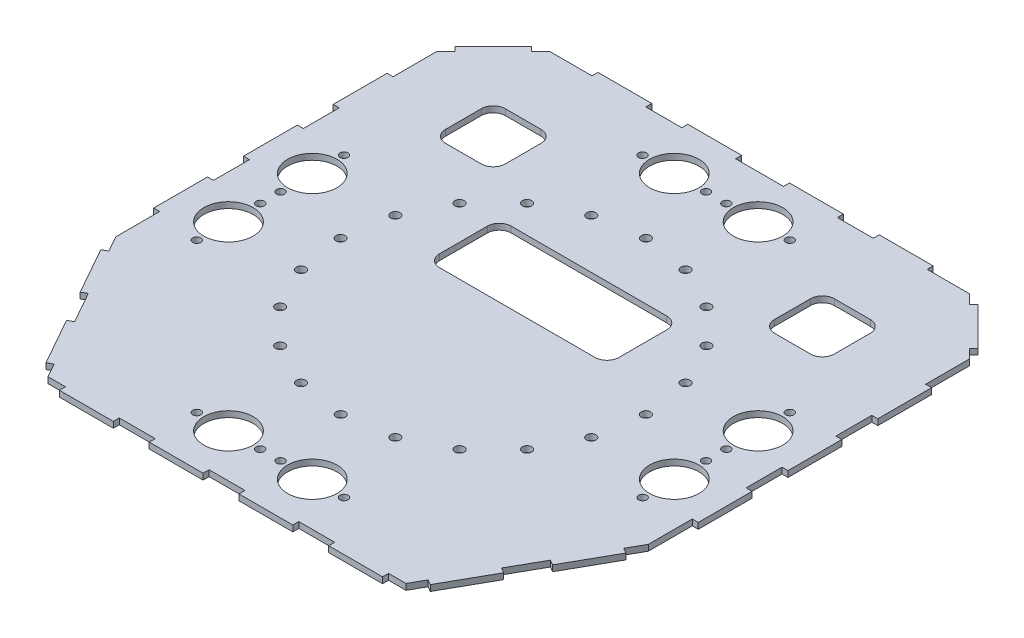
from build123d import *

# Parameters (mm, degrees)
ESQUISSE1_R             = 7.75
ESQUISSE1_R_2           = 41.25
ESQUISSE1_R_3           = 6.75
ESQUISSE1_W             = 300
ESQUISSE1_H             = 120
BOSS_EXTRU_1_DEPTH      = 10
CHANFREIN1_SIZE         = 100
ESQUISSE2_W             = 100
ESQUISSE2_H             = 100
ENL_V_MAT_EXTRU_1_DEPTH = 644.544870231
CONG_1_R                = 20
ESQUISSE3_W             = 1497.809837023
ESQUISSE3_H             = 1280.051047864
ENL_V_MAT_EXTRU_2_DEPTH = 644.544870231


with BuildPart() as part:
    # Esquisse1 → Boss.-Extru.1 (new body)
    with BuildSketch(Plane(origin=(0, 0, 0), x_dir=(1, 0, 0), z_dir=(0, 1, 0))):
        Polygon((455, -188.46717088), (455, 188.46717088), (455, 455), (188.46717088, 455), (-188.46717088, 455), (-455, 455), (-455, 188.46717088), (-455, -188.46717088), (-305, -455), (-188.46717088, -455), (188.46717088, -455), (305, -455), align=None)
        with Locations(Location((-255, 0, 0), (0, 0, 270))):
            Circle(ESQUISSE1_R, mode=Mode.SUBTRACT)
        with Locations(Location((-242.519411655, 78.799333566, 0), (0, 0, 270))):
            Circle(ESQUISSE1_R, mode=Mode.SUBTRACT)
        with Locations(Location((-206.299333566, 149.885239335, 0), (0, 0, 270))):
            Circle(ESQUISSE1_R, mode=Mode.SUBTRACT)
        with Locations(Location((-149.885239335, 206.299333566, 0), (0, 0, 270))):
            Circle(ESQUISSE1_R, mode=Mode.SUBTRACT)
        with Locations(Location((-78.799333566, 242.519411655, 0), (0, 0, 270))):
            Circle(ESQUISSE1_R, mode=Mode.SUBTRACT)
        with Locations(Location((0, 255, 0), (0, 0, 270))):
            Circle(ESQUISSE1_R, mode=Mode.SUBTRACT)
        with Locations(Location((78.799333566, 242.519411655, 0), (0, 0, 270))):
            Circle(ESQUISSE1_R, mode=Mode.SUBTRACT)
        with Locations(Location((149.885239335, 206.299333566, 0), (0, 0, 270))):
            Circle(ESQUISSE1_R, mode=Mode.SUBTRACT)
        with Locations(Location((206.299333566, 149.885239335, 0), (0, 0, 270))):
            Circle(ESQUISSE1_R, mode=Mode.SUBTRACT)
        with Locations(Location((242.519411655, 78.799333566, 0), (0, 0, 270))):
            Circle(ESQUISSE1_R, mode=Mode.SUBTRACT)
        with Locations(Location((255, 0, 0), (0, 0, 270))):
            Circle(ESQUISSE1_R, mode=Mode.SUBTRACT)
        with Locations(Location((242.519411655, -78.799333566, 0), (0, 0, 270))):
            Circle(ESQUISSE1_R, mode=Mode.SUBTRACT)
        with Locations(Location((206.299333566, -149.885239335, 0), (0, 0, 270))):
            Circle(ESQUISSE1_R, mode=Mode.SUBTRACT)
        with Locations(Location((149.885239335, -206.299333566, 0), (0, 0, 270))):
            Circle(ESQUISSE1_R, mode=Mode.SUBTRACT)
        with Locations(Location((78.799333566, -242.519411655, 0), (0, 0, 270))):
            Circle(ESQUISSE1_R, mode=Mode.SUBTRACT)
        with Locations(Location((0, -255, 0), (0, 0, 270))):
            Circle(ESQUISSE1_R, mode=Mode.SUBTRACT)
        with Locations(Location((-78.799333566, -242.519411655, 0), (0, 0, 270))):
            Circle(ESQUISSE1_R, mode=Mode.SUBTRACT)
        with Locations(Location((-149.885239335, -206.299333566, 0), (0, 0, 270))):
            Circle(ESQUISSE1_R, mode=Mode.SUBTRACT)
        with Locations(Location((-206.299333566, -149.885239335, 0), (0, 0, 270))):
            Circle(ESQUISSE1_R, mode=Mode.SUBTRACT)
        with Locations(Location((-242.519411655, -78.799333566, 0), (0, 0, 270))):
            Circle(ESQUISSE1_R, mode=Mode.SUBTRACT)
        with Locations(Location((70, 372.479529639, 0), (0, 0, 270))):
            Circle(ESQUISSE1_R_2, mode=Mode.SUBTRACT)
        with Locations(Location((123, 372.479529639, 0), (0, 0, 270))):
            Circle(ESQUISSE1_R_3, mode=Mode.SUBTRACT)
        with Locations(Location((17, 372.479529639, 0), (0, 0, 270))):
            Circle(ESQUISSE1_R_3, mode=Mode.SUBTRACT)
        with Locations(Location((-17, 372.479529639, 0), (0, 0, 90))):
            Circle(ESQUISSE1_R_3, mode=Mode.SUBTRACT)
        with Locations(Location((-123, 372.479529639, 0), (0, 0, 90))):
            Circle(ESQUISSE1_R_3, mode=Mode.SUBTRACT)
        with Locations(Location((-70, 372.479529639, 0), (0, 0, 90))):
            Circle(ESQUISSE1_R_2, mode=Mode.SUBTRACT)
        with Locations(Location((372.479529639, 70, 0), (0, 0, 90))):
            Circle(ESQUISSE1_R_2, mode=Mode.SUBTRACT)
        with Locations(Location((372.479529639, 17, 0), (0, 0, 90))):
            Circle(ESQUISSE1_R_3, mode=Mode.SUBTRACT)
        with Locations(Location((372.479529639, 123, 0), (0, 0, 90))):
            Circle(ESQUISSE1_R_3, mode=Mode.SUBTRACT)
        with Locations(Location((372.479529639, -70, 0), (0, 0, 270))):
            Circle(ESQUISSE1_R_2, mode=Mode.SUBTRACT)
        with Locations(Location((372.479529639, -123, 0), (0, 0, 270))):
            Circle(ESQUISSE1_R_3, mode=Mode.SUBTRACT)
        with Locations(Location((372.479529639, -17, 0), (0, 0, 270))):
            Circle(ESQUISSE1_R_3, mode=Mode.SUBTRACT)
        with Locations(Location((70, -372.479529639, 0), (0, 0, 90))):
            Circle(ESQUISSE1_R_2, mode=Mode.SUBTRACT)
        with Locations(Location((17, -372.479529639, 0), (0, 0, 90))):
            Circle(ESQUISSE1_R_3, mode=Mode.SUBTRACT)
        with Locations(Location((123, -372.479529639, 0), (0, 0, 90))):
            Circle(ESQUISSE1_R_3, mode=Mode.SUBTRACT)
        with Locations(Location((-70, -372.479529639, 0), (0, 0, 270))):
            Circle(ESQUISSE1_R_2, mode=Mode.SUBTRACT)
        with Locations(Location((-123, -372.479529639, 0), (0, 0, 270))):
            Circle(ESQUISSE1_R_3, mode=Mode.SUBTRACT)
        with Locations(Location((-17, -372.479529639, 0), (0, 0, 270))):
            Circle(ESQUISSE1_R_3, mode=Mode.SUBTRACT)
        with Locations(Location((-372.479529639, -70, 0), (0, 0, 90))):
            Circle(ESQUISSE1_R_2, mode=Mode.SUBTRACT)
        with Locations(Location((-372.479529639, -17, 0), (0, 0, 90))):
            Circle(ESQUISSE1_R_3, mode=Mode.SUBTRACT)
        with Locations(Location((-372.479529639, -123, 0), (0, 0, 90))):
            Circle(ESQUISSE1_R_3, mode=Mode.SUBTRACT)
        with Locations(Location((-372.479529639, 70, 0), (0, 0, 270))):
            Circle(ESQUISSE1_R_2, mode=Mode.SUBTRACT)
        with Locations(Location((-372.479529639, 123, 0), (0, 0, 270))):
            Circle(ESQUISSE1_R_3, mode=Mode.SUBTRACT)
        with Locations(Location((-372.479529639, 17, 0), (0, 0, 270))):
            Circle(ESQUISSE1_R_3, mode=Mode.SUBTRACT)
        with Locations((0, 100)):
            Rectangle(ESQUISSE1_W, ESQUISSE1_H, mode=Mode.SUBTRACT)
    extrude(amount=BOSS_EXTRU_1_DEPTH)

    # Chanfrein1
    chanfrein1_edges = [part.edges().sort_by_distance(p)[0] for p in [
        (-455, 5, -455),
        (455, 5, -455),
    ]]
    chamfer(chanfrein1_edges, length=CHANFREIN1_SIZE)

    # Esquisse2 → Enlèv. mat.-Extru.1 (cut, through all)
    with BuildSketch(Plane(origin=(0, 10, 0), x_dir=(1, 0, 0), z_dir=(0, 1, 0))):
        with Locations((-275, 275)):
            Rectangle(ESQUISSE2_W, ESQUISSE2_H)
        with Locations((275, 275)):
            Rectangle(ESQUISSE2_W, ESQUISSE2_H)
    extrude(amount=-ENL_V_MAT_EXTRU_1_DEPTH, mode=Mode.SUBTRACT)

    # Congé1
    cong_1_edges = [part.edges().sort_by_distance(p)[0] for p in [
        (-150, 5, -160),
        (-150, 5, -40),
        (150, 5, -40),
        (150, 5, -160),
        (-325, 5, -225),
        (-325, 5, -325),
        (-225, 5, -325),
        (-225, 5, -225),
        (225, 5, -325),
        (325, 5, -325),
        (325, 5, -225),
        (225, 5, -225),
    ]]
    fillet(cong_1_edges, radius=CONG_1_R)

    # Esquisse3 → Enlèv. mat.-Extru.2 (cut, through all)
    with BuildSketch(Plane(origin=(0, 10, 0), x_dir=(1, 0, 0), z_dir=(0, 1, 0))):
        with Locations((34.907275201, -41.538880661)):
            Rectangle(ESQUISSE3_W, ESQUISSE3_H)
        Polygon((30, -445), (-30, -445), (-30, -455), (-120, -455), (-120, -445), (-180, -445), (-180, -455), (-270, -455), (-270, -445), (-299.152964676, -445), (-312.431510738, -421.405543677), (-321.146214104, -426.310025835), (-365.286553526, -347.877695539), (-356.57185016, -342.973213381), (-385.998743108, -290.684993183), (-394.713446474, -295.589475341), (-438.853785896, -217.157145045), (-430.13908253, -212.252662887), (-445, -185.846513709), (-445, -112.494324666), (-455, -112.494324666), (-455, -22.494324666), (-445, -22.494324666), (-445, 37.505675334), (-455, 37.505675334), (-455, 127.505675334), (-445, 127.505675334), (-445, 187.505675334), (-455, 187.505675334), (-455, 277.505675334), (-445, 277.505675334), (-445, 350.857864376), (-429.748737342, 366.109127035), (-436.819805153, 373.180194847), (-373.180194847, 436.819805153), (-366.109127035, 429.748737342), (-350.857864376, 445), (-280, 445), (-280, 455), (-190, 455), (-190, 445), (-130, 445), (-130, 455), (-40, 455), (-40, 445), (40, 445), (40, 455), (130, 455), (130, 445), (190, 445), (190, 455), (280, 455), (280, 445), (350.857864376, 445), (366.109127035, 429.748737342), (373.180194847, 436.819805153), (436.819805153, 373.180194847), (429.748737342, 366.109127035), (445, 350.857864376), (445, 277.505675334), (455, 277.505675334), (455, 187.505675334), (445, 187.505675334), (445, 127.505675334), (455, 127.505675334), (455, 37.505675334), (445, 37.505675334), (445, -22.494324666), (455, -22.494324666), (455, -112.494324666), (445, -112.494324666), (445, -185.846513709), (430.13908253, -212.252662887), (438.853785896, -217.157145045), (394.713446474, -295.589475341), (385.998743108, -290.684993183), (356.57185016, -342.973213381), (365.286553526, -347.877695539), (321.146214104, -426.310025835), (312.431510738, -421.405543677), (299.152964676, -445), (270, -445), (270, -455), (180, -455), (180, -445), (120, -445), (120, -455), (30, -455), align=None, mode=Mode.SUBTRACT)
    extrude(amount=-ENL_V_MAT_EXTRU_2_DEPTH, mode=Mode.SUBTRACT)


solid = part.part
